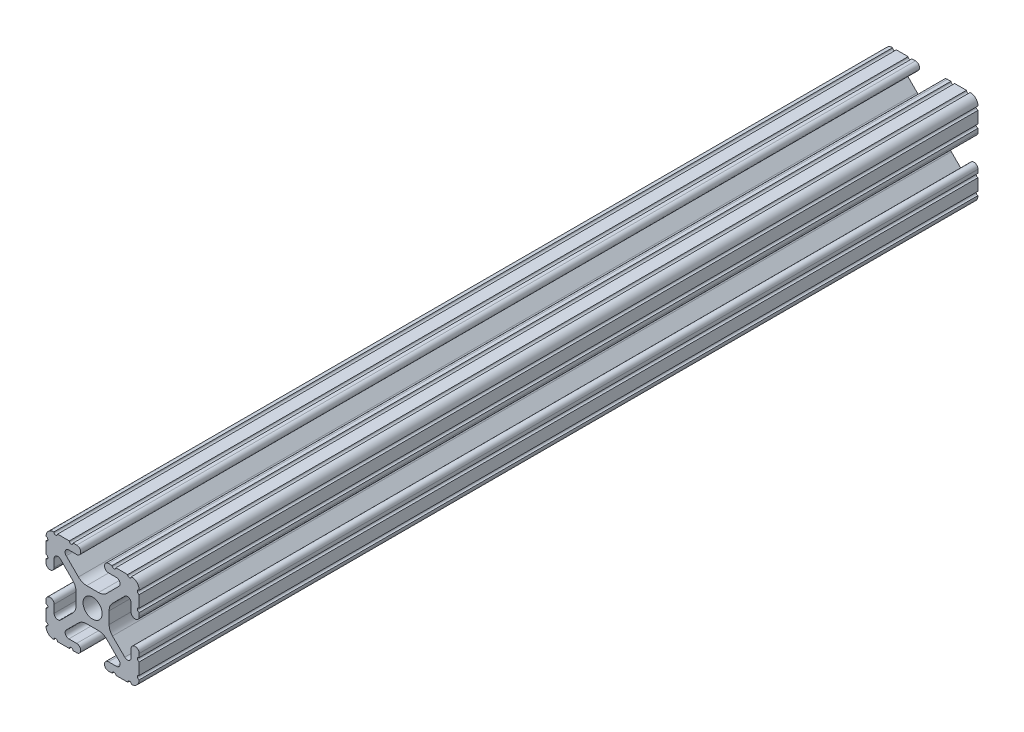
from build123d import *

# Parameters (mm, degrees)
SKETCH1_R           = 2.6035
BOSS_EXTRUDE1_DEPTH = 228.6


with BuildPart() as part:
    # Sketch1 → Boss-Extrude1 (new body)
    with BuildSketch(Plane(origin=(0, 0, -25.4), x_dir=(-1, 0, 0), z_dir=(0, 0, -1))):
        with BuildLine():
            Line((12.7, -9.5504), (12.7, -6.3330836))
            ThreePointArc((12.7, -6.3330836), (12.192, -5.8250836), (12.7, -5.3170836))
            Line((12.7, -5.3170836), (12.7, -4.3434))
            ThreePointArc((12.7, -4.3434), (11.5951, -3.2385), (10.4902, -4.3434))
            Line((10.4902, -4.3434), (10.4902, -6.474794456))
            ThreePointArc((10.4902, -6.474794456), (9.863006367, -7.413456061), (8.75577951, -7.193214945))
            Line((8.75577951, -7.193214945), (5.42573597, -3.863171405))
            ThreePointArc((5.42573597, -3.863171405), (4.737482484, -2.833127272), (4.4958, -1.618107374))
            Line((4.4958, -1.618107374), (4.4958, 1.618107374))
            ThreePointArc((4.4958, 1.618107374), (4.737482484, 2.833127272), (5.42573597, 3.863171405))
            Line((5.42573597, 3.863171405), (8.75577951, 7.193214945))
            ThreePointArc((8.75577951, 7.193214945), (9.863006367, 7.413456061), (10.4902, 6.474794456))
            Line((10.4902, 6.474794456), (10.4902, 4.343399971))
            ThreePointArc((10.4902, 4.343399971), (11.5951, 3.238499971), (12.7, 4.343399971))
            Line((12.7, 4.343399971), (12.7, 5.3170836))
            ThreePointArc((12.7, 5.3170836), (12.192, 5.8250836), (12.7, 6.3330836))
            Line((12.7, 6.3330836), (12.7, 9.5504))
            ThreePointArc((12.7, 9.5504), (12.192000006, 10.058323491), (12.699846982, 10.566399977))
            ThreePointArc((12.699846982, 10.566399977), (12.082522516, 12.082522516), (10.566399977, 12.699846982))
            ThreePointArc((10.566399977, 12.699846982), (10.058323491, 12.192000006), (9.5504, 12.7))
            Line((9.5504, 12.7), (6.3330836, 12.7))
            ThreePointArc((6.3330836, 12.7), (5.8250836, 12.192), (5.3170836, 12.7))
            Line((5.3170836, 12.7), (4.3434, 12.7))
            ThreePointArc((4.3434, 12.7), (3.2385, 11.5951), (4.3434, 10.4902))
            Line((4.3434, 10.4902), (6.474794456, 10.4902))
            ThreePointArc((6.474794456, 10.4902), (7.413456061, 9.863006367), (7.193214945, 8.75577951))
            Line((7.193214945, 8.75577951), (3.863171405, 5.42573597))
            ThreePointArc((3.863171405, 5.42573597), (2.833127272, 4.737482484), (1.618107374, 4.4958))
            Line((1.618107374, 4.4958), (-1.618107374, 4.4958))
            ThreePointArc((-1.618107374, 4.4958), (-2.833127272, 4.737482484), (-3.863171405, 5.42573597))
            Line((-3.863171405, 5.42573597), (-7.193214945, 8.75577951))
            ThreePointArc((-7.193214945, 8.75577951), (-7.413456061, 9.863006367), (-6.474794456, 10.4902))
            Line((-6.474794456, 10.4902), (-4.343399971, 10.4902))
            ThreePointArc((-4.343399971, 10.4902), (-3.238499971, 11.5951), (-4.343399971, 12.7))
            Line((-4.343399971, 12.7), (-5.3170836, 12.7))
            ThreePointArc((-5.3170836, 12.7), (-5.8250836, 12.192), (-6.3330836, 12.7))
            Line((-6.3330836, 12.7), (-9.5504, 12.7))
            ThreePointArc((-9.5504, 12.7), (-10.058323491, 12.192000006), (-10.566399977, 12.699846982))
            ThreePointArc((-10.566399977, 12.699846982), (-12.082522516, 12.082522516), (-12.699846982, 10.566399977))
            ThreePointArc((-12.699846982, 10.566399977), (-12.192000006, 10.058323491), (-12.7, 9.5504))
            Line((-12.7, 9.5504), (-12.7, 6.3330836))
            ThreePointArc((-12.7, 6.3330836), (-12.192, 5.8250836), (-12.7, 5.3170836))
            Line((-12.7, 5.3170836), (-12.7, 4.3434))
            ThreePointArc((-12.7, 4.3434), (-11.5951, 3.2385), (-10.4902, 4.3434))
            Line((-10.4902, 4.3434), (-10.4902, 6.474794456))
            ThreePointArc((-10.4902, 6.474794456), (-9.863006367, 7.413456061), (-8.75577951, 7.193214945))
            Line((-8.75577951, 7.193214945), (-5.42573597, 3.863171405))
            ThreePointArc((-5.42573597, 3.863171405), (-4.737482484, 2.833127272), (-4.4958, 1.618107374))
            Line((-4.4958, 1.618107374), (-4.4958, -1.618107374))
            ThreePointArc((-4.4958, -1.618107374), (-4.737482484, -2.833127272), (-5.42573597, -3.863171405))
            Line((-5.42573597, -3.863171405), (-8.75577951, -7.193214945))
            ThreePointArc((-8.75577951, -7.193214945), (-9.863006367, -7.413456061), (-10.4902, -6.474794456))
            Line((-10.4902, -6.474794456), (-10.4902, -4.343399971))
            ThreePointArc((-10.4902, -4.343399971), (-11.5951, -3.238499971), (-12.7, -4.343399971))
            Line((-12.7, -4.343399971), (-12.7, -5.3170836))
            ThreePointArc((-12.7, -5.3170836), (-12.192, -5.8250836), (-12.7, -6.3330836))
            Line((-12.7, -6.3330836), (-12.7, -9.5504))
            ThreePointArc((-12.7, -9.5504), (-12.192000006, -10.058323491), (-12.699846982, -10.566399977))
            ThreePointArc((-12.699846982, -10.566399977), (-12.082522516, -12.082522516), (-10.566399977, -12.699846982))
            ThreePointArc((-10.566399977, -12.699846982), (-10.058323491, -12.192000006), (-9.5504, -12.7))
            Line((-9.5504, -12.7), (-6.3330836, -12.7))
            ThreePointArc((-6.3330836, -12.7), (-5.8250836, -12.192), (-5.3170836, -12.7))
            Line((-5.3170836, -12.7), (-4.3434, -12.7))
            ThreePointArc((-4.3434, -12.7), (-3.2385, -11.5951), (-4.3434, -10.4902))
            Line((-4.3434, -10.4902), (-6.474794456, -10.4902))
            ThreePointArc((-6.474794456, -10.4902), (-7.413456061, -9.863006367), (-7.193214945, -8.75577951))
            Line((-7.193214945, -8.75577951), (-3.863171405, -5.42573597))
            ThreePointArc((-3.863171405, -5.42573597), (-2.833127272, -4.737482484), (-1.618107374, -4.4958))
            Line((-1.618107374, -4.4958), (1.618107374, -4.4958))
            ThreePointArc((1.618107374, -4.4958), (2.833127272, -4.737482484), (3.863171405, -5.42573597))
            Line((3.863171405, -5.42573597), (7.193214945, -8.75577951))
            ThreePointArc((7.193214945, -8.75577951), (7.413456061, -9.863006367), (6.474794456, -10.4902))
            Line((6.474794456, -10.4902), (4.343399971, -10.4902))
            ThreePointArc((4.343399971, -10.4902), (3.238499971, -11.5951), (4.343399971, -12.7))
            Line((4.343399971, -12.7), (5.3170836, -12.7))
            ThreePointArc((5.3170836, -12.7), (5.8250836, -12.192), (6.3330836, -12.7))
            Line((6.3330836, -12.7), (9.5504, -12.7))
            ThreePointArc((9.5504, -12.7), (10.058323491, -12.192000006), (10.566399977, -12.699846982))
            ThreePointArc((10.566399977, -12.699846982), (12.082522516, -12.082522516), (12.699846982, -10.566399977))
            ThreePointArc((12.699846982, -10.566399977), (12.192000006, -10.058323491), (12.7, -9.5504))
        make_face()
        with Locations(Location((0, 0, 0), (0, 0, 180))):
            Circle(SKETCH1_R, mode=Mode.SUBTRACT)
    extrude(amount=-BOSS_EXTRUDE1_DEPTH)


solid = part.part
